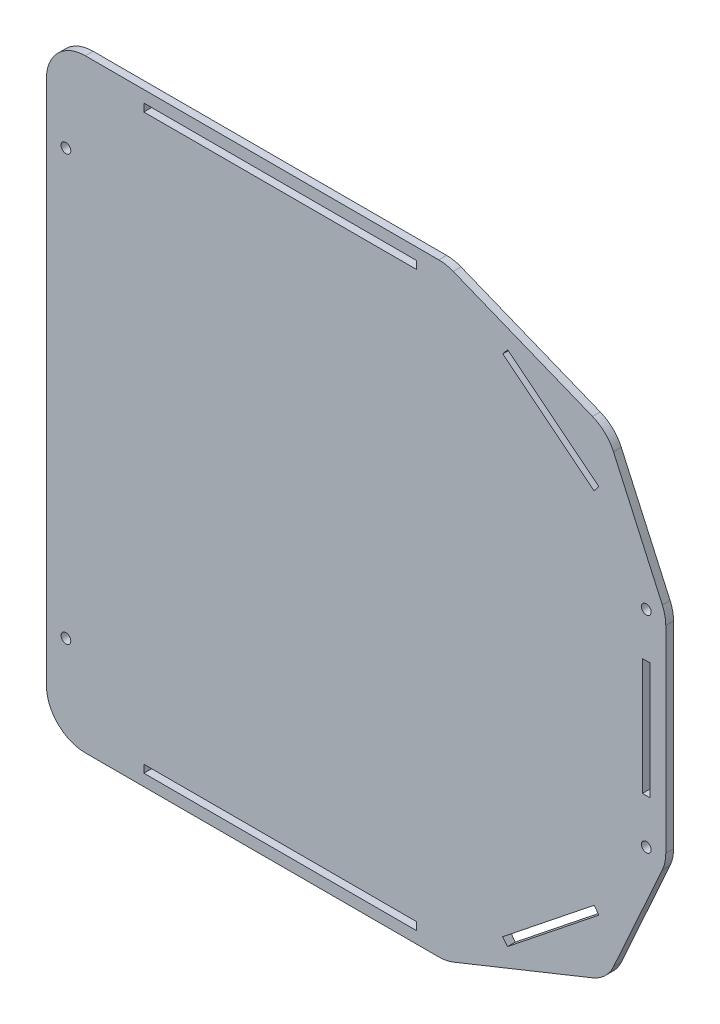
from build123d import *

# Parameters (mm, degrees)
ESTRUSIONE_ESTRUSIONE1_DEPTH = 2
FORO_FILETTATO_M3X0_5_1_D    = 2.5
SCHIZZO4_W                   = 70
SCHIZZO4_H                   = 2
TAGLIO_ESTRUSIONE1_DEPTH     = 10
FORO_FILETTATO_M3X0_5_2_D    = 2.5
SCHIZZO7_W                   = 2
SCHIZZO7_H                   = 30
TAGLIO_ESTRUSIONE2_DEPTH     = 10
RACCORDO1_R                  = 10
RACCORDO2_R                  = 10


with BuildPart() as part:
    # Schizzo1 → Estrusione-Estrusione1 (new body)
    with BuildSketch(Plane.XY):
        Polygon((11.657840491, -77.5), (52.921246524, -60.909710617), (68, -27.5), (68, 27.5), (52.921246524, 60.909710617), (11.657840491, 77.5), (-91, 77.5), (-91, -77.5), align=None)
    extrude(amount=ESTRUSIONE_ESTRUSIONE1_DEPTH)

    # Foro filettato M3x0.5-1 (through all)
    with Locations(Plane(origin=(0, 0, 0), x_dir=(-1, 0, 0), z_dir=(0, 0, -1))):
        with Locations((86, -54.5), (86, 54.5)):
            Hole(FORO_FILETTATO_M3X0_5_1_D / 2)

    # Schizzo4 → Taglio-Estrusione1 (cut)
    with BuildSketch(Plane(origin=(0, 0, 0), x_dir=(-1, 0, 0), z_dir=(0, 0, -1))):
        with Locations((31, -73.5)):
            Rectangle(SCHIZZO4_W, SCHIZZO4_H)
        with Locations((31, 73.5)):
            Rectangle(SCHIZZO4_W, SCHIZZO4_H)
    extrude(amount=-TAGLIO_ESTRUSIONE1_DEPTH, mode=Mode.SUBTRACT)

    # Foro filettato M3x0.5-2 (through all)
    with Locations(Plane.XY.offset(2)):
        with Locations((63, 26.42393853), (63, -26.42393853)):
            Hole(FORO_FILETTATO_M3X0_5_2_D / 2)

    # Schizzo7 → Taglio-Estrusione2 (cut)
    with BuildSketch(Plane.XY.offset(2)):
        Polygon((27.388202482, 66.352391197), (50.838277007, 47.641592048), (49.590890397, 46.078253746), (26.140815873, 64.789052895), align=None)
        Polygon((49.590890397, -46.078253746), (26.140815873, -64.789052895), (27.388202482, -66.352391197), (50.838277007, -47.641592048), align=None)
        with Locations((63, 0)):
            Rectangle(SCHIZZO7_W, SCHIZZO7_H)
    extrude(amount=-TAGLIO_ESTRUSIONE2_DEPTH, mode=Mode.SUBTRACT)

    # Raccordo1
    raccordo1_edges = [part.edges().sort_by_distance(p)[0] for p in [
        (-91, 77.5, 1),
        (-91, -77.5, 1),
    ]]
    fillet(raccordo1_edges, radius=RACCORDO1_R)

    # Raccordo2
    raccordo2_edges = [part.edges().sort_by_distance(p)[0] for p in [
        (11.657840491, 77.5, 1),
        (52.921246524, 60.909710617, 1),
        (68, 27.5, 1),
        (68, -27.5, 1),
        (52.921246524, -60.909710617, 1),
        (11.657840491, -77.5, 1),
    ]]
    fillet(raccordo2_edges, radius=RACCORDO2_R)


solid = part.part
